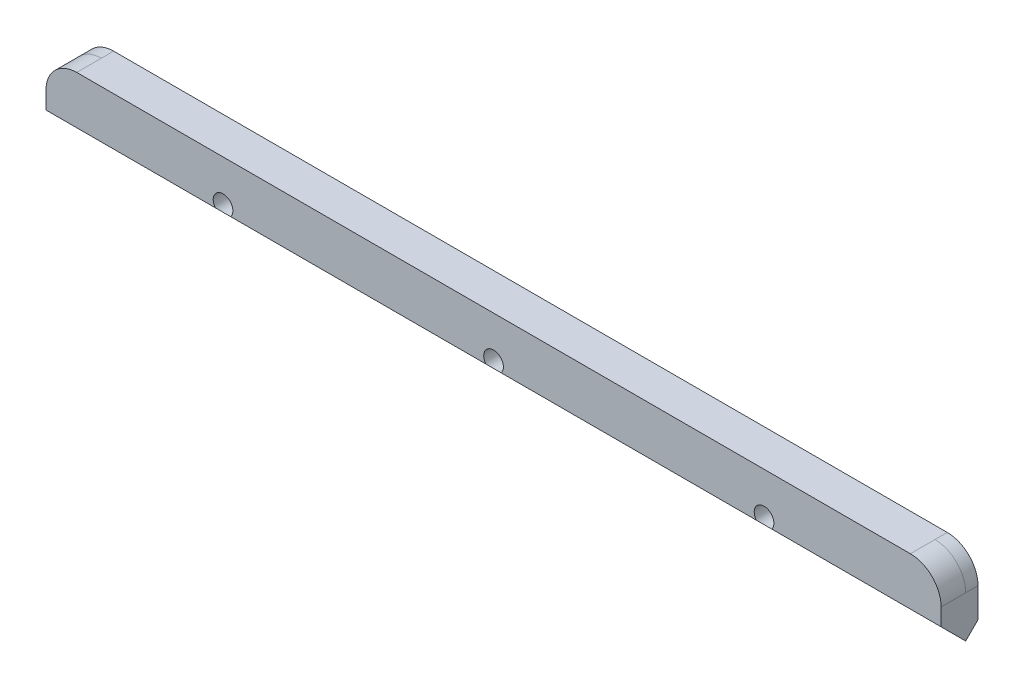
from build123d import *

# Parameters (mm, degrees)
BOSS_EXTRUDE1_DEPTH       = 36.4
FILLET3_R                 = 2.5
CUT_EXTRUDE5_DEPTH        = 72.8
BOSS_EXTRUDE2_DEPTH       = 72.8
M2X0_4_TAPPED_HOLE1_D     = 1.6
M2X0_4_TAPPED_HOLE1_DEPTH = 3.6
M2X0_4_TAPPED_HOLE1_TIP   = 0.480688495
FILLET4_R                 = 2.5


with BuildPart() as part:
    # Sketch1 → Boss-Extrude1 (new, symmetric)
    with BuildSketch(Plane(origin=(0, 0, 0), x_dir=(0, 0, -1), z_dir=(1, 0, 0))):
        Polygon((0, -3.2), (-2, -1.2), (-2, 3.2), (0, 3.2), align=None)
    extrude(amount=BOSS_EXTRUDE1_DEPTH, both=True)

    # Fillet3
    fillet3_edges = [part.edges().sort_by_distance(p)[0] for p in [
        (-36.4, 3.2, 1),
        (36.4, 3.2, 1),
    ]]
    fillet(fillet3_edges, radius=FILLET3_R)

    # Sketch5 → Cut-Extrude5 (cut)
    with BuildSketch(Plane.ZY.offset(36.4)):
        Polygon((0, -2.7), (2, -0.7), (2, -1.2), (0, -3.2), align=None)
    extrude(amount=-CUT_EXTRUDE5_DEPTH, mode=Mode.SUBTRACT)

    # Sketch7 → Boss-Extrude2 (add)
    with BuildSketch(Plane.ZY.offset(36.4)):
        Polygon((0, -2.7), (-1, -1.7), (-1, 3.2), (0, 3.2), align=None)
    extrude(amount=-BOSS_EXTRUDE2_DEPTH)

    # M2x0.4 Tapped Hole1
    with Locations(Plane.XY.offset(2)):
        with Locations((-22, -0.2), (22, -0.2), (0, -0.2)):
            Hole(M2X0_4_TAPPED_HOLE1_D / 2, depth=M2X0_4_TAPPED_HOLE1_DEPTH)
            with Locations((0, 0, -(M2X0_4_TAPPED_HOLE1_DEPTH + M2X0_4_TAPPED_HOLE1_TIP / 2))):  # 118° drill point
                Cone(0, M2X0_4_TAPPED_HOLE1_D / 2, M2X0_4_TAPPED_HOLE1_TIP, mode=Mode.SUBTRACT)

    # Fillet4
    fillet4_edges = [part.edges().sort_by_distance(p)[0] for p in [
        (-36.4, 3.2, -0.5),
        (36.4, 3.2, -0.5),
    ]]
    fillet(fillet4_edges, radius=FILLET4_R)


solid = part.part
